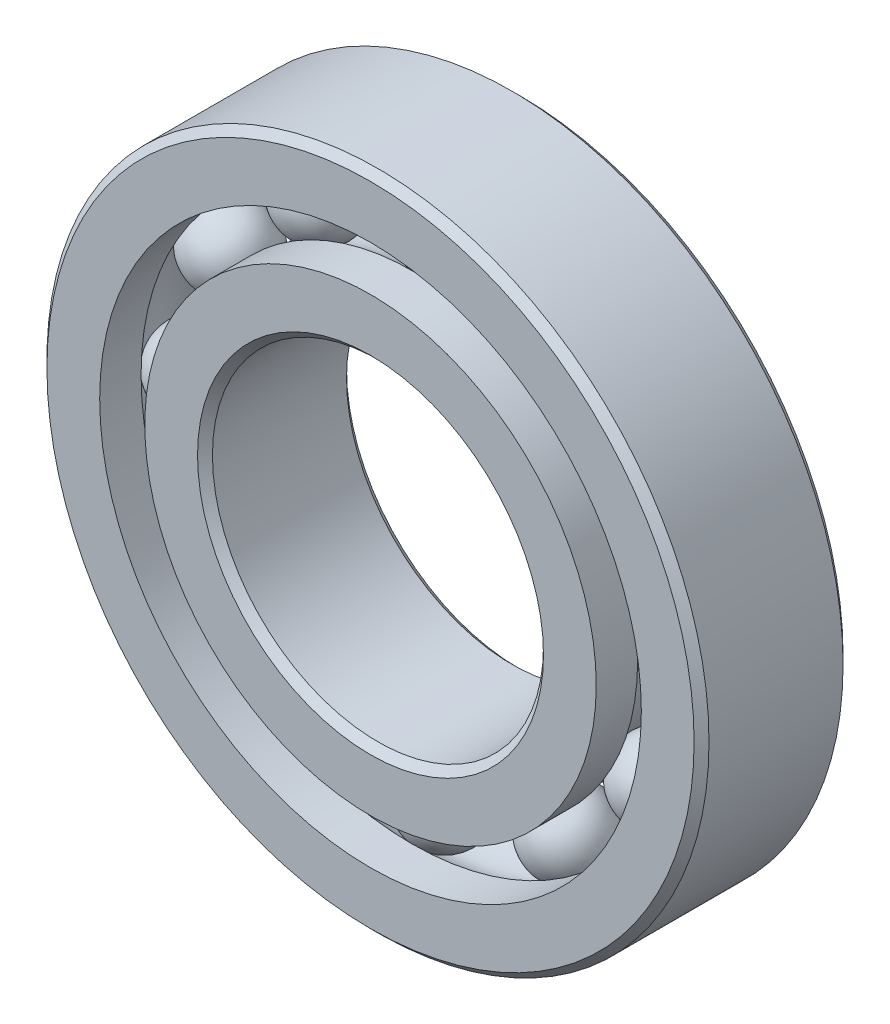
from build123d import *

# Parameters (mm, degrees)
CIRPATTERN1_COUNT = 12


with BuildPart() as part:
    # Sketch1 → Revolve1 (revolve)
    with BuildSketch(Plane(origin=(0, 0, 0), x_dir=(0, 0, -1), z_dir=(1, 0, 0))):
        with BuildLine():
            Line((8.1, 40), (-8.1, 40))
            Line((-8.1, 40), (-9, 39.1))
            Line((-9, 39.1), (-9, 32.725274725))
            Line((-9, 32.725274725), (-4, 32.725274725))
            ThreePointArc((-4, 32.725274725), (0, 34.840157263), (4, 32.725274725))
            Line((4, 32.725274725), (9, 32.725274725))
            Line((9, 32.725274725), (9, 39.1))
            Line((9, 39.1), (8.1, 40))
        make_face()
    revolve(axis=Axis((0, 0, 9), (0, 0, -1)))


with BuildPart() as body_2:
    # Sketch3 → Revolve3 (revolve)
    with BuildSketch(Plane(origin=(0, 0, 0), x_dir=(0, 0, -1), z_dir=(1, 0, 0))):
        with BuildLine():
            Line((-9, 27.274725275), (-4, 27.274725275))
            ThreePointArc((-4, 27.274725275), (0, 25.159842737), (4, 27.274725275))
            Line((4, 27.274725275), (9, 27.274725275))
            Line((9, 27.274725275), (9, 20.9))
            Line((9, 20.9), (8.1, 20))
            Line((8.1, 20), (-8.1, 20))
            Line((-8.1, 20), (-9, 20.9))
            Line((-9, 20.9), (-9, 27.274725275))
        make_face()
    revolve(axis=Axis((0, 0, 9), (0, 0, -1)))


with BuildPart() as body_3:
    # Sketch4 → Revolve4 (revolve)
    with BuildSketch(Plane(origin=(0, 0, 0), x_dir=(0, 0, -1), z_dir=(1, 0, 0))):
        with BuildLine():
            Line((-4.840157263, 30), (4.840157263, 30))
            ThreePointArc((4.840157263, 30), (0, 34.840157263), (-4.840157263, 30))
        make_face()
    revolve(axis=Axis((0, 30, 4.840157263), (0, 0, -1)))


with BuildPart() as cirpattern1_1:
    # CirPattern1: pattern copy
    add(body_3.part.rotate(Axis((0, 0, -9), (0, 0, 1)), 1 * 360 / CIRPATTERN1_COUNT))


with BuildPart() as cirpattern1_2:
    # CirPattern1: pattern copy
    add(body_3.part.rotate(Axis((0, 0, -9), (0, 0, 1)), 2 * 360 / CIRPATTERN1_COUNT))


with BuildPart() as cirpattern1_3:
    # CirPattern1: pattern copy
    add(body_3.part.rotate(Axis((0, 0, -9), (0, 0, 1)), 3 * 360 / CIRPATTERN1_COUNT))


with BuildPart() as cirpattern1_4:
    # CirPattern1: pattern copy
    add(body_3.part.rotate(Axis((0, 0, -9), (0, 0, 1)), 4 * 360 / CIRPATTERN1_COUNT))


with BuildPart() as cirpattern1_5:
    # CirPattern1: pattern copy
    add(body_3.part.rotate(Axis((0, 0, -9), (0, 0, 1)), 5 * 360 / CIRPATTERN1_COUNT))


with BuildPart() as cirpattern1_6:
    # CirPattern1: pattern copy
    add(body_3.part.rotate(Axis((0, 0, -9), (0, 0, 1)), 6 * 360 / CIRPATTERN1_COUNT))


with BuildPart() as cirpattern1_7:
    # CirPattern1: pattern copy
    add(body_3.part.rotate(Axis((0, 0, -9), (0, 0, 1)), 7 * 360 / CIRPATTERN1_COUNT))


with BuildPart() as cirpattern1_8:
    # CirPattern1: pattern copy
    add(body_3.part.rotate(Axis((0, 0, -9), (0, 0, 1)), 8 * 360 / CIRPATTERN1_COUNT))


with BuildPart() as cirpattern1_9:
    # CirPattern1: pattern copy
    add(body_3.part.rotate(Axis((0, 0, -9), (0, 0, 1)), 9 * 360 / CIRPATTERN1_COUNT))


with BuildPart() as cirpattern1_10:
    # CirPattern1: pattern copy
    add(body_3.part.rotate(Axis((0, 0, -9), (0, 0, 1)), 10 * 360 / CIRPATTERN1_COUNT))


with BuildPart() as cirpattern1_11:
    # CirPattern1: pattern copy
    add(body_3.part.rotate(Axis((0, 0, -9), (0, 0, 1)), 11 * 360 / CIRPATTERN1_COUNT))


solid = Compound([part.part, body_2.part, body_3.part, cirpattern1_1.part, cirpattern1_2.part, cirpattern1_3.part, cirpattern1_4.part, cirpattern1_5.part, cirpattern1_6.part, cirpattern1_7.part, cirpattern1_8.part, cirpattern1_9.part, cirpattern1_10.part, cirpattern1_11.part])
